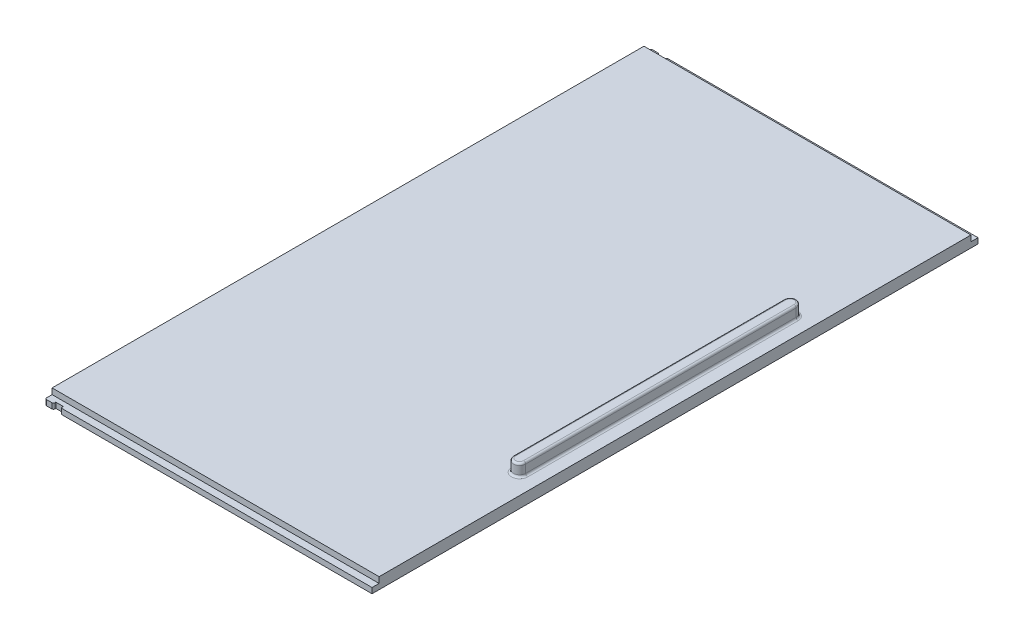
from build123d import *

# Parameters (mm, degrees)
SKETCH1_W           = 81
SKETCH1_H           = 153
BOSS_EXTRUDE1_DEPTH = 3
CUT_EXTRUDE2_DEPTH  = 81
CUT_EXTRUDE3_DEPTH  = 81
SKETCH6_W           = 1.85
SKETCH6_H           = 1.55
CUT_EXTRUDE5_DEPTH  = 0.6
FILLET6_R           = 0.4
CHAMFER2_SIZE       = 0.2
SKETCH7_W           = 1.85
SKETCH7_H           = 1.55
CUT_EXTRUDE6_DEPTH  = 0.6
FILLET7_R           = 0.4
CHAMFER3_SIZE       = 0.2
SKETCH10_W          = 81
SKETCH10_H          = 150.1
CUT_EXTRUDE7_DEPTH  = 0.2
FILLET8_R           = 0.4
BOSS_EXTRUDE2_DEPTH = 3
FILLET10_R          = 0.5


with BuildPart() as part:
    # Sketch1 → Boss-Extrude1 (new body)
    with BuildSketch(Plane(origin=(0, 0, 0), x_dir=(1, 0, 0), z_dir=(0, 1, 0))):
        with Locations((40.5, 76.5)):
            Rectangle(SKETCH1_W, SKETCH1_H)
    extrude(amount=BOSS_EXTRUDE1_DEPTH)

    # Sketch2 → Cut-Extrude2 (cut)
    with BuildSketch(Plane(origin=(81, 0, 0), x_dir=(0, 0, -1), z_dir=(1, 0, 0))):
        Polygon((0, 3), (3, 3), (3, 1.75), (1.25, 1.75), (1.25, 0), (0, 0), align=None)
        Polygon((151.75, 0), (153, 0), (153, 3), (150, 3), (150, 1.75), (151.75, 1.75), align=None)
    extrude(amount=-CUT_EXTRUDE2_DEPTH, mode=Mode.SUBTRACT)

    # Sketch4 → Cut-Extrude3 (cut)
    with BuildSketch(Plane(origin=(81, 0, 0), x_dir=(0, 0, -1), z_dir=(1, 0, 0))):
        Polygon((3.2, 3), (3, 3), (3, 1.75), (1.25, 1.75), (1.25, 0), (1.45, 0), (1.45, 1.55), (3.2, 1.55), align=None)
        Polygon((151.75, 0), (151.55, 0), (151.55, 1.55), (149.8, 1.55), (149.8, 3), (150, 3), (150, 1.75), (151.75, 1.75), align=None)
    extrude(amount=-CUT_EXTRUDE3_DEPTH, mode=Mode.SUBTRACT)

    # Sketch6 → Cut-Extrude5 (cut)
    with BuildSketch(Plane.XY.offset(-1.45)):
        with Locations((3, 0.775)):
            Rectangle(SKETCH6_W, SKETCH6_H)
    extrude(amount=-CUT_EXTRUDE5_DEPTH, mode=Mode.SUBTRACT)

    # Fillet6
    fillet6_edges = [part.edges().sort_by_distance(p)[0] for p in [
        (2.075, 0.775, -1.45),
    ]]
    fillet(fillet6_edges, radius=FILLET6_R)

    # Chamfer2
    chamfer2_edges = [part.edges().sort_by_distance(p)[0] for p in [
        (3.925, 0.775, -1.45),
    ]]
    chamfer(chamfer2_edges, length=CHAMFER2_SIZE)

    # Sketch7 → Cut-Extrude6 (cut)
    with BuildSketch(Plane(origin=(0, 0, -151.55), x_dir=(-1, 0, 0), z_dir=(0, 0, -1))):
        with Locations((-3, 0.775)):
            Rectangle(SKETCH7_W, SKETCH7_H)
    extrude(amount=-CUT_EXTRUDE6_DEPTH, mode=Mode.SUBTRACT)

    # Fillet7
    fillet7_edges = [part.edges().sort_by_distance(p)[0] for p in [
        (2.075, 0.775, -151.55),
    ]]
    fillet(fillet7_edges, radius=FILLET7_R)

    # Chamfer3
    chamfer3_edges = [part.edges().sort_by_distance(p)[0] for p in [
        (3.925, 0.775, -151.55),
    ]]
    chamfer(chamfer3_edges, length=CHAMFER3_SIZE)

    # Sketch10 → Cut-Extrude7 (cut)
    with BuildSketch(Plane(origin=(0, 0, 0), x_dir=(-1, 0, 0), z_dir=(0, -1, 0))):
        with Locations((-40.5, 76.5)):
            Rectangle(SKETCH10_W, SKETCH10_H)
    extrude(amount=-CUT_EXTRUDE7_DEPTH, mode=Mode.SUBTRACT)

    # Fillet8
    fillet8_edges = [part.edges().sort_by_distance(p)[0] for p in [
        (0, 0.875, -151.55),
        (0, 0.875, -1.45),
    ]]
    fillet(fillet8_edges, radius=FILLET8_R)

    # Sketch9 → Boss-Extrude2 (add)
    with BuildSketch(Plane(origin=(0, 3, 0), x_dir=(1, 0, 0), z_dir=(0, 1, 0))):
        with BuildLine():
            Line((74.5, 43), (74.5, 110))
            ThreePointArc((74.5, 110), (76, 111.5), (77.5, 110))
            Line((77.5, 110), (77.5, 43))
            ThreePointArc((77.5, 43), (76, 41.5), (74.5, 43))
        make_face()
    extrude(amount=BOSS_EXTRUDE2_DEPTH)

    # Fillet10
    fillet10_edges = [part.edges().sort_by_distance(p)[0] for p in [
        (76, 3, -41.5),
        (77.5, 3, -76.5),
        (76, 3, -111.5),
        (74.5, 3, -76.5),
        (76, 6, -41.5),
        (77.5, 6, -76.5),
        (76, 6, -111.5),
        (74.5, 6, -76.5),
    ]]
    fillet(fillet10_edges, radius=FILLET10_R)


solid = part.part
